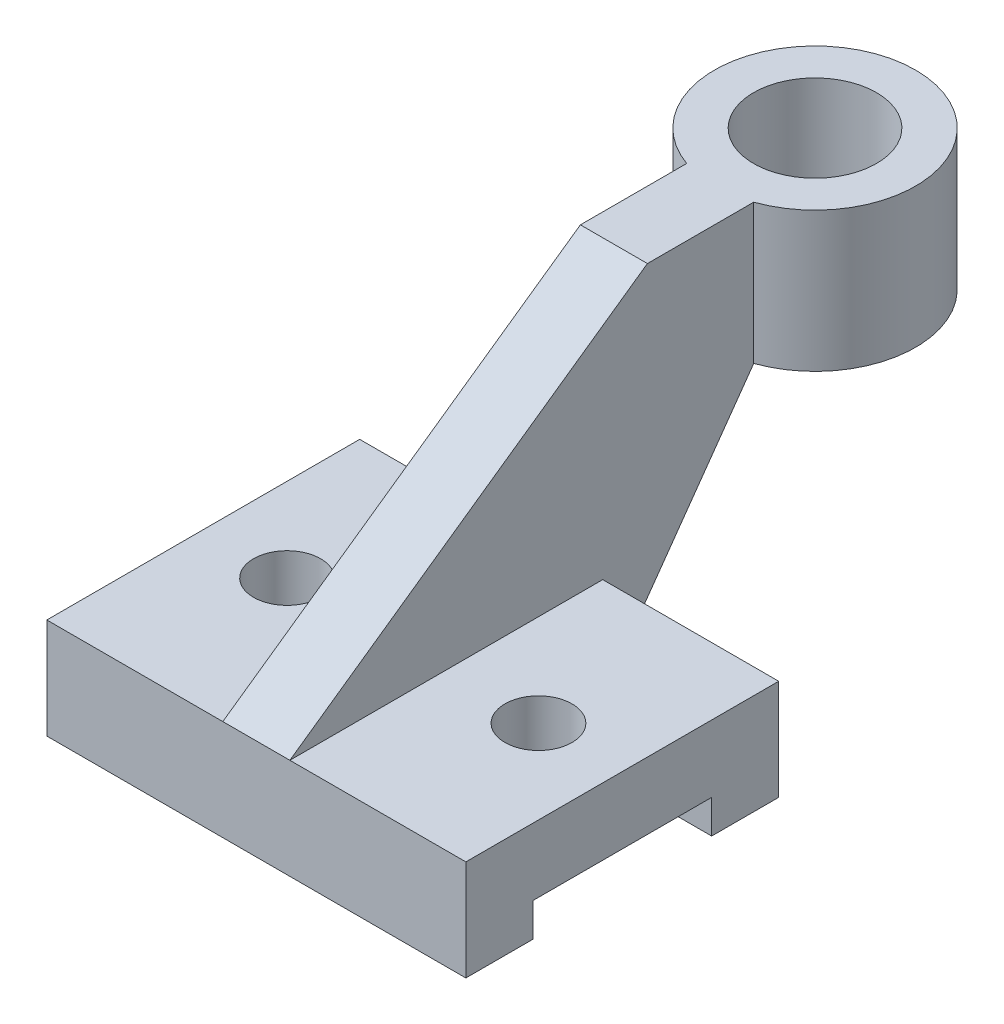
from build123d import *

# Parameters (mm, degrees)
ESQUISSE4_W             = 75
ESQUISSE4_H             = 56
BOSS_EXTRU_2_DEPTH      = 18
ESQUISSE5_R             = 6
ENL_V_MAT_EXTRU_3_DEPTH = 51.142297514
ESQUISSE6_W             = 32
ESQUISSE6_H             = 6
ENL_V_MAT_EXTRU_4_DEPTH = 83.054859698
ESQUISSE9_R             = 18
ESQUISSE9_R_2           = 11
BOSS_EXTRU_3_DEPTH      = 25
BOSS_EXTRU_6_REACH      = 99.32
BOSS_EXTRU_6_END_RADIUS = 18
ESQUISSE10_W            = 12
ESQUISSE10_H            = 25
BOSS_EXTRU_7_DEPTH      = 6


with BuildPart() as part:
    # Esquisse4 → Boss.-Extru.2 (new body)
    with BuildSketch(Plane(origin=(0, 0, 0), x_dir=(1, 0, 0), z_dir=(0, 1, 0))):
        Rectangle(ESQUISSE4_W, ESQUISSE4_H)
    extrude(amount=BOSS_EXTRU_2_DEPTH)

    # Esquisse5 → Enlèv. mat.-Extru.3 (cut, through all)
    with BuildSketch(Plane(origin=(0, 18, 0), x_dir=(1, 0, 0), z_dir=(0, 1, 0))):
        with Locations(Location((22.5, 0, 0), (0, 0, 270))):
            Circle(ESQUISSE5_R)
    enl_v_mat_extru_3 = extrude(amount=-ENL_V_MAT_EXTRU_3_DEPTH, mode=Mode.SUBTRACT)

    # Symétrie1: Enlèv. mat.-Extru.3 across plane
    add(enl_v_mat_extru_3.mirror(Plane(origin=(0, 0, 0), x_dir=(0, 0, 1), z_dir=(1, 0, 0))), mode=Mode.SUBTRACT)

    # Esquisse6 → Enlèv. mat.-Extru.4 (cut, through all)
    with BuildSketch(Plane(origin=(37.5, 0, 0), x_dir=(0, 0, -1), z_dir=(1, 0, 0))):
        with Locations((0, 3)):
            Rectangle(ESQUISSE6_W, ESQUISSE6_H)
    extrude(amount=-ENL_V_MAT_EXTRU_4_DEPTH, mode=Mode.SUBTRACT)



with BuildPart() as body_2:
    # Esquisse9 → Boss.-Extru.3 (new body)
    with BuildSketch(Plane(origin=(0, 63, 0), x_dir=(-1, 0, 0), z_dir=(0, -1, 0))):
        with Locations(Location((0, 72, 0), (0, 0, 90))):
            Circle(ESQUISSE9_R)
        with Locations(Location((0, 72, 0), (0, 0, 90))):
            Circle(ESQUISSE9_R_2, mode=Mode.SUBTRACT)
    extrude(amount=BOSS_EXTRU_3_DEPTH)

    # Boss.-Extru.6: up to this cylinder (the profile starts outside it)
    boss_extru_6_end = Plane(origin=(0, 50.5, -72), z_dir=(0, 1, 0)) * Cylinder(BOSS_EXTRU_6_END_RADIUS, 235.64, mode=Mode.PRIVATE)
    # Esquisse10 → Boss.-Extru.6 (add, up to the surface)
    with BuildSketch(Plane.XY.offset(-36), mode=Mode.PRIVATE) as boss_extru_6_sk1:
        with Locations((0, 50.5)):
            Rectangle(ESQUISSE10_W, ESQUISSE10_H)
    boss_extru_6_tool1 = extrude(boss_extru_6_sk1.sketch, amount=-BOSS_EXTRU_6_REACH, mode=Mode.PRIVATE) - boss_extru_6_end
    add(boss_extru_6_tool1.solids().sort_by_distance((0, 50.5, -36))[0])


with BuildPart() as part_1:
    add(part.part)

    add(body_2.part)  # Boss.-Extru.7 merges body 2
    # Esquisse11 → Boss.-Extru.7 (add, symmetric)
    with BuildSketch(Plane(origin=(0, 0, 0), x_dir=(0, 0, -1), z_dir=(1, 0, 0))):
        Polygon((36, 63), (-28, 18), (28, 18), (28, 0), (55.029437252, 38), (36, 38), align=None)
    extrude(amount=BOSS_EXTRU_7_DEPTH, both=True)


solid = part_1.part
